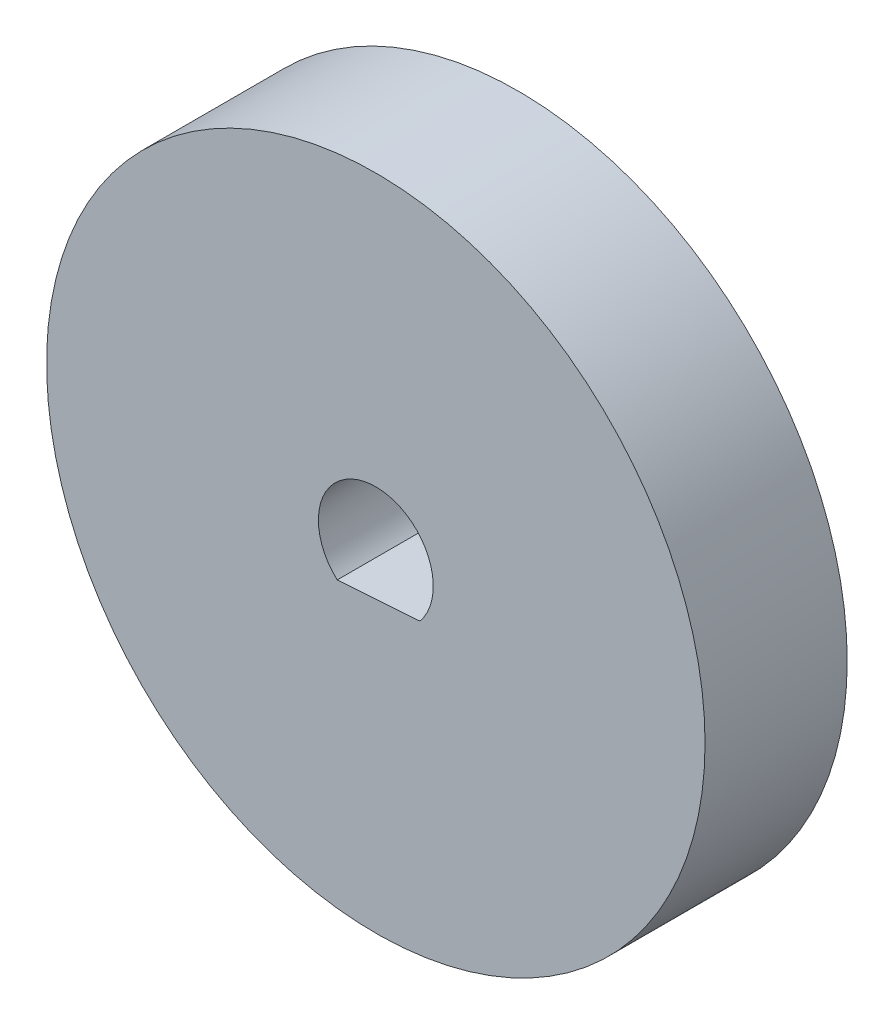
from build123d import *

# Parameters (mm, degrees)
SKETCH1_R           = 11.176
BOSS_EXTRUDE1_DEPTH = 4.826
CUT_EXTRUDE1_DEPTH  = 23.117231703


with BuildPart() as part:
    # Sketch1 → Boss-Extrude1 (new body)
    with BuildSketch(Plane.XY):
        with Locations((0, 7.2896082)):
            Circle(SKETCH1_R)
    extrude(amount=BOSS_EXTRUDE1_DEPTH)

    # Sketch2 → Cut-Extrude1 (cut, through all)
    with BuildSketch(Plane(origin=(0, 0, 0), x_dir=(-1, 0, 0), z_dir=(0, 0, -1))):
        with BuildLine():
            ThreePointArc((1.95, 7.2896082), (-0.664736598, 9.122809022), (-1.496795133, 6.039766478))
            Line((-1.496795133, 6.039766478), (1.310766563, 5.845866181))
            ThreePointArc((1.310766563, 5.845866181), (1.783044419, 6.50014471), (1.95, 7.2896082))
        make_face()
    extrude(amount=-CUT_EXTRUDE1_DEPTH, mode=Mode.SUBTRACT)


solid = part.part
